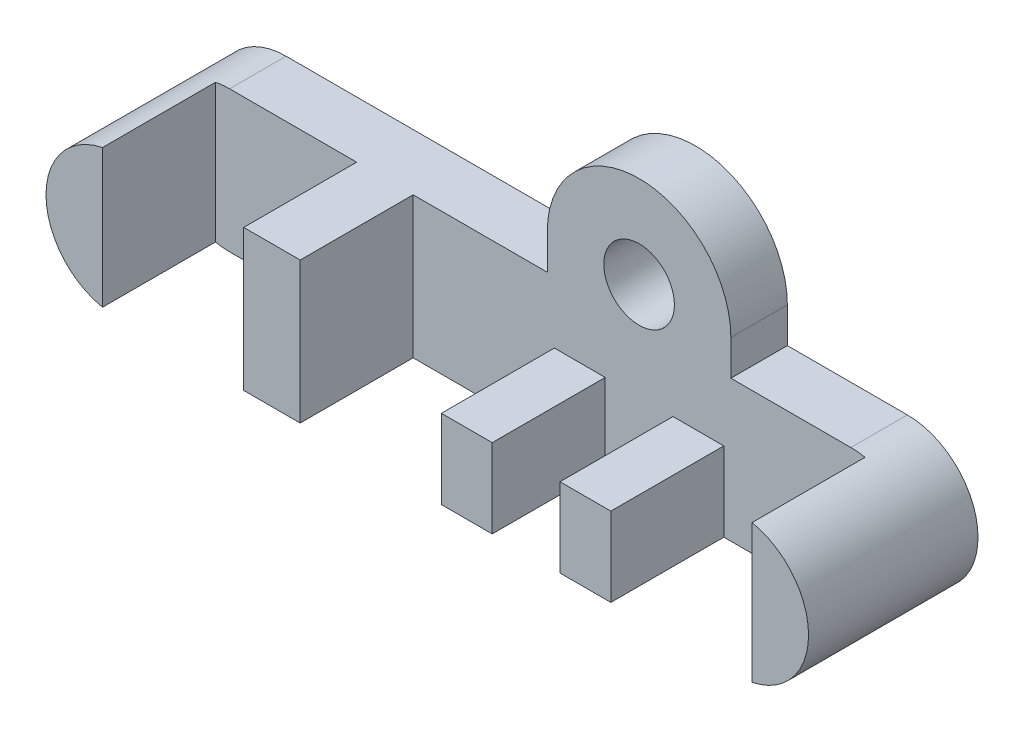
from build123d import *

# Parameters (mm, degrees)
SKETCH1_R           = 1.25
BOSS_EXTRUDE1_DEPTH = 2
SKETCH2_W           = 1.8
SKETCH2_H           = 2.8
SKETCH2_W_2         = 2
SKETCH2_H_2         = 5
BOSS_EXTRUDE2_DEPTH = 4


with BuildPart() as part:
    # Sketch1 → Boss-Extrude1 (new body)
    with BuildSketch(Plane.XY):
        with BuildLine():
            Line((-14.5, -1.25), (-3.25, -1.25))
            Line((-3.25, -1.25), (-3.25, 0))
            ThreePointArc((-3.25, 0), (0, 3.25), (3.25, 0))
            Line((3.25, 0), (3.25, -1.25))
            Line((3.25, -1.25), (7.5, -1.25))
            ThreePointArc((7.5, -1.25), (10, -3.75), (7.5, -6.25))
            Line((7.5, -6.25), (-14.5, -6.25))
            ThreePointArc((-14.5, -6.25), (-17, -3.75), (-14.5, -1.25))
        make_face()
        Circle(SKETCH1_R, mode=Mode.SUBTRACT)
    extrude(amount=BOSS_EXTRUDE1_DEPTH)

    # Sketch2 → Boss-Extrude2 (add)
    with BuildSketch(Plane.XY.offset(2)):
        with Locations((-2.1, -4.85)):
            Rectangle(SKETCH2_W, SKETCH2_H)
        with Locations((2.1, -4.85)):
            Rectangle(SKETCH2_W, SKETCH2_H)
        with Locations((-9, -3.75)):
            Rectangle(SKETCH2_W_2, SKETCH2_H_2)
        with BuildLine():
            ThreePointArc((8, -6.199489743), (10, -3.75), (8, -1.300510257))
            Line((8, -1.300510257), (8, -6.199489743))
        make_face()
        with BuildLine():
            Line((-15, -6.199489743), (-15, -1.300510257))
            ThreePointArc((-15, -1.300510257), (-17, -3.75), (-15, -6.199489743))
        make_face()
    extrude(amount=BOSS_EXTRUDE2_DEPTH)


solid = part.part
